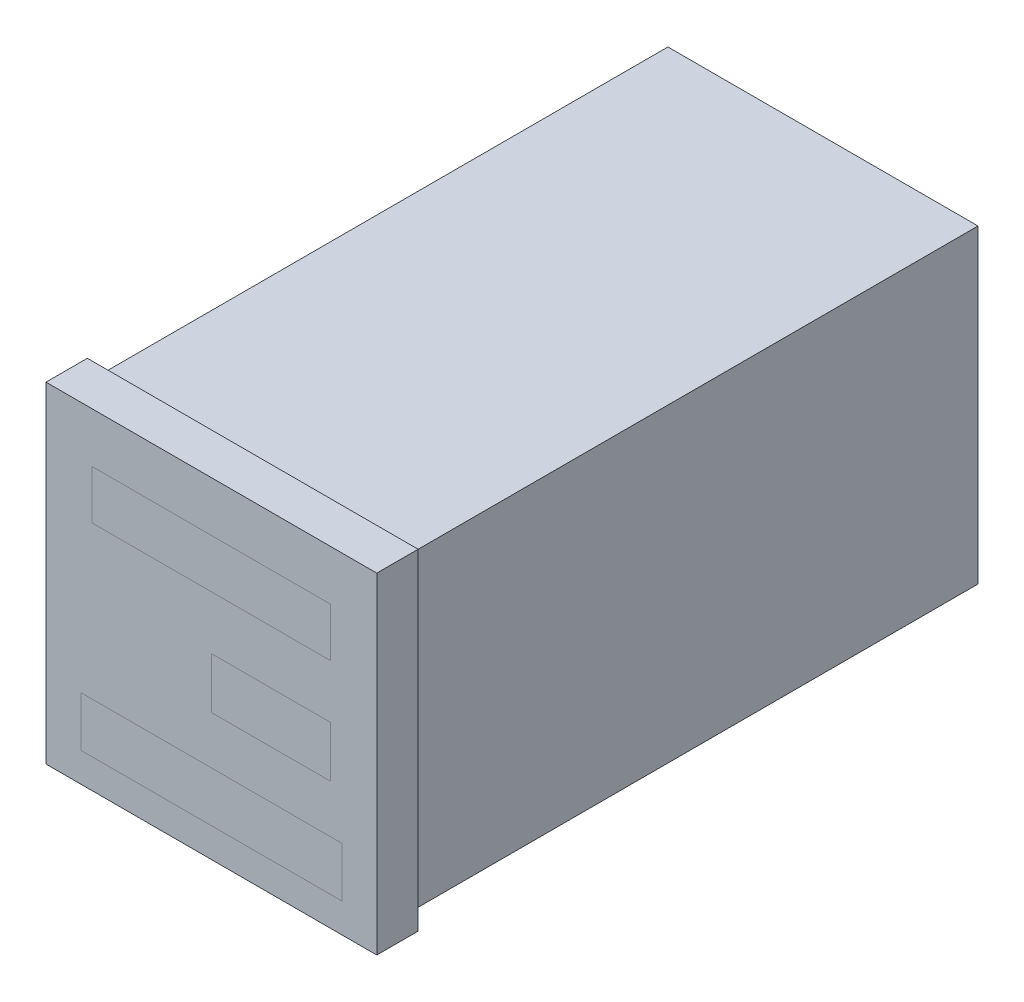
from build123d import *

# Parameters (mm, degrees)
SKETCH1_W           = 48
SKETCH1_H           = 48
BOSS_EXTRUDE1_DEPTH = 6
SKETCH2_W           = 45
SKETCH2_H           = 45
BOSS_EXTRUDE2_DEPTH = 82.75


with BuildPart() as part:
    # Sketch1 → Boss-Extrude1 (new body)
    with BuildSketch(Plane.XY):
        Rectangle(SKETCH1_W, SKETCH1_H)
    extrude(amount=-BOSS_EXTRUDE1_DEPTH)

    # Sketch2 → Boss-Extrude2 (add)
    with BuildSketch(Plane(origin=(0, 0, -6), x_dir=(-1, 0, 0), z_dir=(0, 0, -1))):
        Rectangle(SKETCH2_W, SKETCH2_H)
    extrude(amount=BOSS_EXTRUDE2_DEPTH)


solid = part.part
